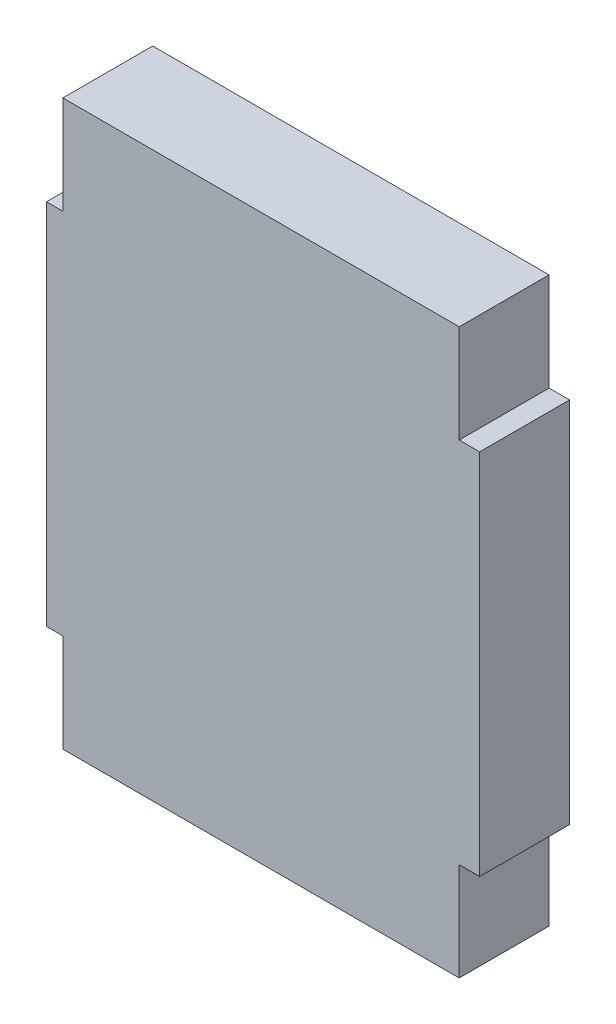
from build123d import *

# Parameters (mm, degrees)
COMPONENT_OUTLINE_DEPTH = 1.1


with BuildPart() as part:
    # 草图1 → Component_Outline (new body)
    with BuildSketch(Plane.XY):
        Polygon((2.675, -2.25), (2.425, -2.25), (2.425, -3.45), (-2.425, -3.45), (-2.425, -2.25), (-2.625, -2.25), (-2.625, 2.25), (-2.425, 2.25), (-2.425, 3.45), (2.425, 3.45), (2.425, 2.25), (2.675, 2.25), align=None)
    extrude(amount=COMPONENT_OUTLINE_DEPTH)


solid = part.part
